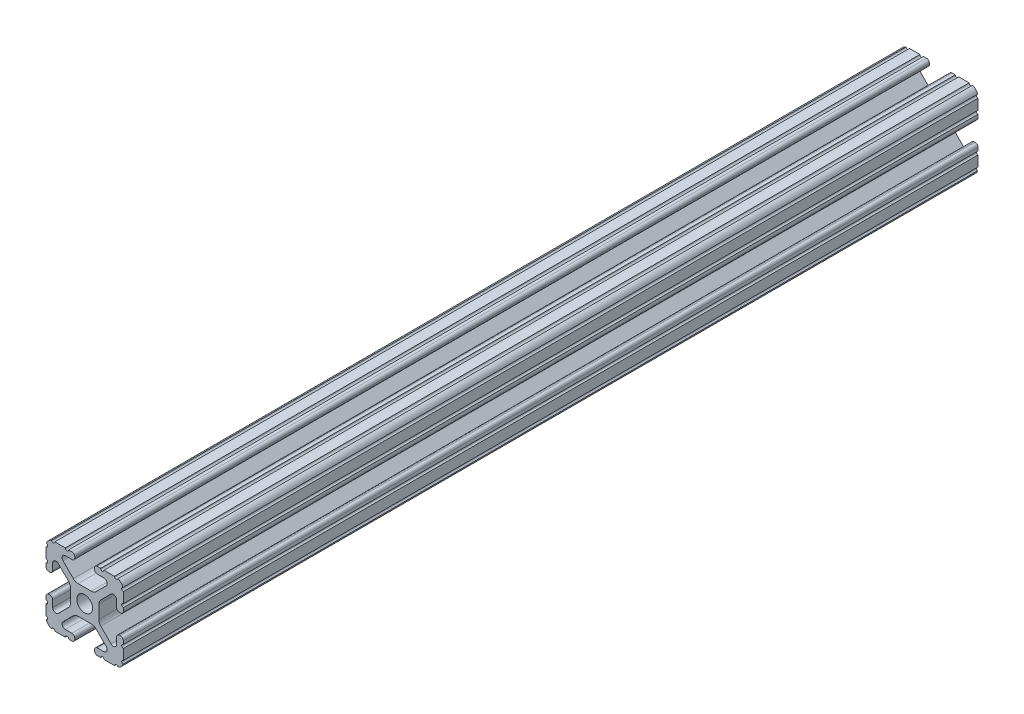
from build123d import *

# Parameters (mm, degrees)
BOSS_EXTRUDE1_START     = -140.36268
BOSS_EXTRUDE1_DEPTH     = 280.72536
CUT_EXTRUDE1_DEPTH      = 142.507109139
CUT_EXTRUDE1_DEPTH_BACK = 142.507109139
SKETCH5_R               = 0.55245


with BuildPart() as part:
    # Sketch4 → Boss-Extrude1 (new body)
    with BuildSketch(Plane.XY.offset(BOSS_EXTRUDE1_START)):
        with BuildLine():
            Line((4.190365, -12.7), (10.11729625, -12.7))
            ThreePointArc((10.11729625, -12.7), (11.943543585, -11.943543585), (12.7, -10.11729625))
            Line((12.7, -10.11729625), (12.7, -4.190365))
            ThreePointArc((12.7, -4.190365), (12.42492494, -3.52627506), (11.760835, -3.2512))
            Line((11.760835, -3.2512), (11.429365, -3.2512))
            ThreePointArc((11.429365, -3.2512), (10.76527506, -3.52627506), (10.4902, -4.190365))
            Line((10.4902, -4.190365), (10.4902, -6.348478019))
            ThreePointArc((10.4902, -6.348478019), (9.830707141, -7.335478831), (8.666460301, -7.103895736))
            Line((8.666460301, -7.103895736), (5.299899128, -3.737334563))
            ThreePointArc((5.299899128, -3.737334563), (4.817571085, -3.015479634), (4.6482, -2.16399369))
            Line((4.6482, -2.16399369), (4.6482, 0))
            Line((4.6482, 0), (2.6035, 0))
            ThreePointArc((2.6035, 0), (1.840952505, -1.840952505), (0, -2.6035))
            Line((0, -2.6035), (0, -4.6482))
            Line((0, -4.6482), (2.16399369, -4.6482))
            ThreePointArc((2.16399369, -4.6482), (3.015479634, -4.817571085), (3.737334563, -5.299899128))
            Line((3.737334563, -5.299899128), (7.103895736, -8.666460301))
            ThreePointArc((7.103895736, -8.666460301), (7.335478831, -9.830707141), (6.348478019, -10.4902))
            Line((6.348478019, -10.4902), (4.190365, -10.4902))
            ThreePointArc((4.190365, -10.4902), (3.52627506, -10.76527506), (3.2512, -11.429365))
            Line((3.2512, -11.429365), (3.2512, -11.760835))
            ThreePointArc((3.2512, -11.760835), (3.52627506, -12.42492494), (4.190365, -12.7))
        make_face()
    extrude(amount=BOSS_EXTRUDE1_DEPTH)

    # Sketch5 → Cut-Extrude1 (cut, two sides: drawn at the far end of the back side and taken through both)
    with BuildSketch(Plane.XY.offset(-CUT_EXTRUDE1_DEPTH_BACK)):
        with Locations((10.356153152, -12.7)):
            Circle(SKETCH5_R)
        with Locations((5.796028019, -12.7)):
            Circle(SKETCH5_R)
        with Locations((12.7, -10.356153152)):
            Circle(SKETCH5_R)
        with Locations((12.7, -5.796028019)):
            Circle(SKETCH5_R)
    extrude(amount=CUT_EXTRUDE1_DEPTH + CUT_EXTRUDE1_DEPTH_BACK, mode=Mode.SUBTRACT)

    # Mirror1: part across plane


with BuildPart() as part_1:
    add(part.part)
    add(part.part.mirror(Plane(origin=(0, 0, 0), x_dir=(0, 0, 1), z_dir=(1, 0, 0))))

    # Mirror2: part across plane


with BuildPart() as part_2:
    add(part_1.part)
    add(part_1.part.mirror(Plane.ZX))


solid = part_2.part
